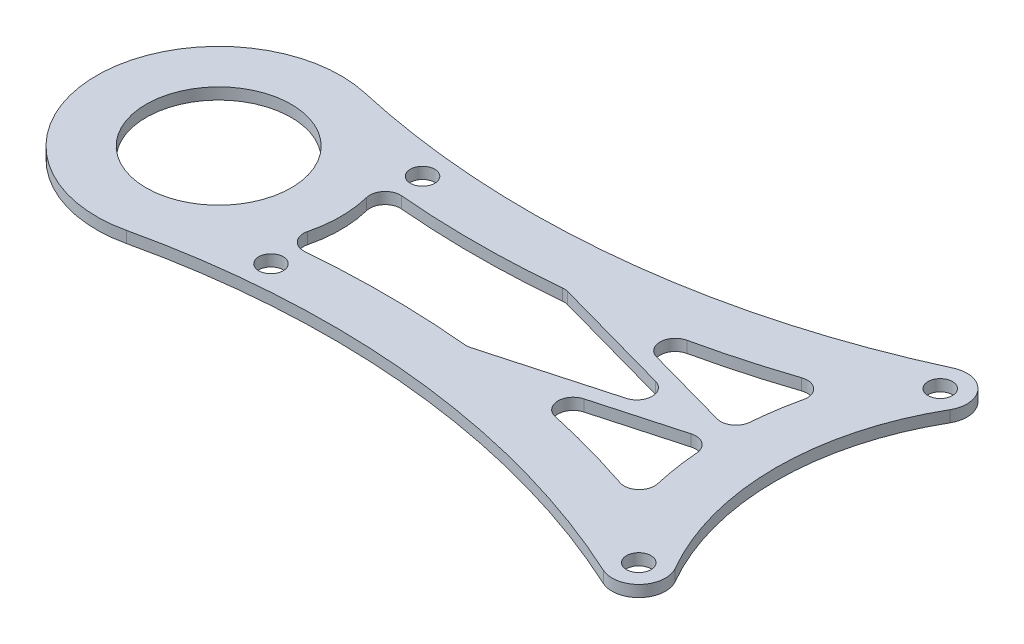
from build123d import *

# Parameters (mm, degrees)
SKETCH1_R                      = 3.5
BOSS_EXTRUDE1_DEPTH            = 0.75
F_3_2_3_2_DIAMETER_HOLE1_D     = 3.2
F_3_2_3_2_DIAMETER_HOLE1_DEPTH = 10
F_3_2_3_2_DIAMETER_HOLE1_TIP   = 0.96137699
CUT_EXTRUDE1_DEPTH             = 128.152713302
FILLET1_R                      = 2
SKETCH7_R                      = 9.5
CUT_EXTRUDE2_DEPTH             = 128.15271342


with BuildPart() as part:
    # Sketch1 → Boss-Extrude1 (new, symmetric)
    with BuildSketch(Plane(origin=(0, 0, 0), x_dir=(1, 0, 0), z_dir=(0, 1, 0))):
        with BuildLine():
            ThreePointArc((-37.239092363, -21.5), (-43, 0), (-37.239092363, 21.5))
            ThreePointArc((-37.239092363, 21.5), (-36.567343094, 22.335249783), (-35.674318722, 22.928037055))
            ThreePointArc((-35.674318722, 22.928037055), (-69.961373448, 13.496685886), (-105.45946442, 15.603352454))
            ThreePointArc((-105.45946442, 15.603352454), (-125, 0), (-105.45946442, -15.603352454))
            ThreePointArc((-105.45946442, -15.603352454), (-69.961373448, -13.496685886), (-35.674318722, -22.928037055))
            ThreePointArc((-35.674318722, -22.928037055), (-36.567343094, -22.335249783), (-37.239092363, -21.5))
        make_face()
        with BuildLine():
            ThreePointArc((-31.176914536, 18), (-35.958003449, 16.718911087), (-37.239092363, 21.5))
            ThreePointArc((-37.239092363, 21.5), (-43, 0), (-37.239092363, -21.5))
            ThreePointArc((-37.239092363, -21.5), (-35.958003449, -16.718911087), (-31.176914536, -18))
            ThreePointArc((-31.176914536, -18), (-36, 0), (-31.176914536, 18))
        make_face()
        with Locations((-34.208003449, -19.75)):
            Circle(SKETCH1_R)
        with Locations((-34.208003449, 19.75)):
            Circle(SKETCH1_R)
    extrude(amount=BOSS_EXTRUDE1_DEPTH, both=True)

    # Ø3.2 (3.2) Diameter Hole1
    with Locations(Plane(origin=(0, 0.75, 0), x_dir=(1, 0, 0), z_dir=(0, 1, 0))):
        with Locations((-34.208003449, 19.75), (-34.208003449, -19.75), (-92.21668251, 9.928255337), (-92.21668251, -9.928255337)):
            Hole(F_3_2_3_2_DIAMETER_HOLE1_D / 2, depth=F_3_2_3_2_DIAMETER_HOLE1_DEPTH)
            with Locations((0, 0, -(F_3_2_3_2_DIAMETER_HOLE1_DEPTH + F_3_2_3_2_DIAMETER_HOLE1_TIP / 2))):  # 118° drill point
                Cone(0, F_3_2_3_2_DIAMETER_HOLE1_D / 2, F_3_2_3_2_DIAMETER_HOLE1_TIP, mode=Mode.SUBTRACT)

    # Sketch6 → Cut-Extrude1 (cut, through all)
    with BuildSketch(Plane(origin=(0, 0.75, 0), x_dir=(1, 0, 0), z_dir=(0, 1, 0))):
        with BuildLine():
            Line((-69.980899838, -6.458648161), (-46.735459102, 0))
            Line((-46.735459102, 0), (-69.980899838, 6.458648161))
            ThreePointArc((-69.980899838, 6.458648161), (-82.217649484, 5.904514504), (-94.444607799, 6.643836082))
            ThreePointArc((-94.444607799, 6.643836082), (-93, 0), (-94.444607799, -6.643836082))
            ThreePointArc((-94.444607799, -6.643836082), (-82.217649484, -5.904514504), (-69.980899838, -6.458648161))
        make_face()
        with BuildLine():
            Line((-64.779742297, 7.089291637), (-42.987555952, 1.03442411))
            ThreePointArc((-42.987555952, 1.03442411), (-42.397380289, 7.173712054), (-40.934970503, 13.165416435))
            ThreePointArc((-40.934970503, 13.165416435), (-52.695786799, 9.493300195), (-64.779742297, 7.089291637))
        make_face()
        with BuildLine():
            ThreePointArc((-40.934970503, -13.165416435), (-42.397380289, -7.173712054), (-42.987555952, -1.03442411))
            Line((-42.987555952, -1.03442411), (-64.779742297, -7.089291637))
            ThreePointArc((-64.779742297, -7.089291637), (-52.695786799, -9.493300195), (-40.934970503, -13.165416435))
        make_face()
    extrude(amount=-CUT_EXTRUDE1_DEPTH, mode=Mode.SUBTRACT)

    # Fillet1
    fillet1_edges = [part.edges().sort_by_distance(p)[0] for p in [
        (-94.444607799, 0, 6.643836082),
        (-94.444607799, 0, -6.643836082),
        (-69.980899838, 0, -6.458648161),
        (-46.735459102, 0, 0),
        (-69.980899838, 0, 6.458648161),
        (-40.934970503, 0, -13.165416435),
        (-42.987555952, 0, -1.03442411),
        (-64.779742297, 0, -7.089291637),
        (-42.987555952, 0, 1.03442411),
        (-40.934970503, 0, 13.165416435),
        (-64.779742297, 0, 7.089291637),
    ]]
    fillet(fillet1_edges, radius=FILLET1_R)

    # Sketch7 → Cut-Extrude2 (cut, through all)
    with BuildSketch(Plane(origin=(0, 0.75, 0), x_dir=(1, 0, 0), z_dir=(0, 1, 0))):
        with Locations(Location((-109, 0, 0), (0, 0, 270))):
            Circle(SKETCH7_R)
    extrude(amount=-CUT_EXTRUDE2_DEPTH, mode=Mode.SUBTRACT)


solid = part.part
